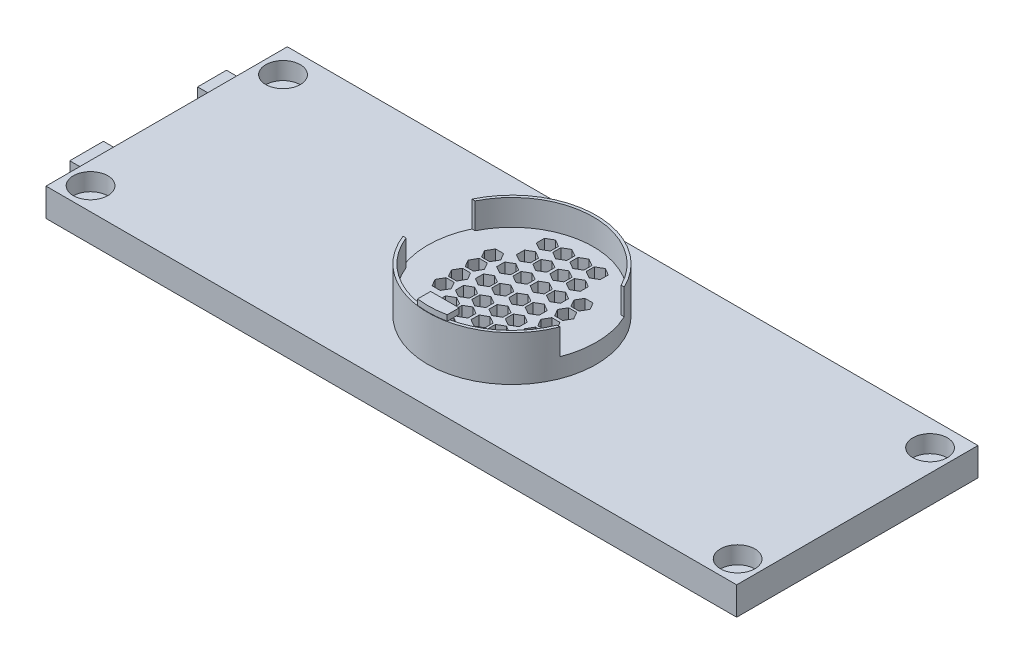
from build123d import *

# Parameters (mm, degrees)
SKETCH1_W           = 122.98346252
SKETCH1_H           = 42.97487903
BOSS_EXTRUDE1_DEPTH = 5
SKETCH3_R           = 3.075
CUT_EXTRUDE1_DEPTH  = 3.1
SKETCH5_W           = 5.142433448
SKETCH5_H           = 2
SKETCH5_W_2         = 6
SKETCH5_H_2         = 2.003550683
BOSS_EXTRUDE2_DEPTH = 3.1
SKETCH6_R           = 15
BOSS_EXTRUDE3_DEPTH = 8
SKETCH8_R           = 14.5
CUT_EXTRUDE2_DEPTH  = 4.6
SKETCH9_W           = 39.287811744
SKETCH9_H           = 11.865369085
CUT_EXTRUDE5_DEPTH  = 9.6
BOSS_EXTRUDE5_DEPTH = 1
CUT_EXTRUDE6_DEPTH  = 10


with BuildPart() as part:
    # Sketch1 → Boss-Extrude1 (new body)
    with BuildSketch(Plane(origin=(0, 0, 0), x_dir=(1, 0, 0), z_dir=(0, 1, 0))):
        Rectangle(SKETCH1_W, SKETCH1_H)
    extrude(amount=BOSS_EXTRUDE1_DEPTH)

    # Sketch3 → Cut-Extrude1 (cut)
    with BuildSketch(Plane(origin=(0, 5, 0), x_dir=(1, 0, 0), z_dir=(0, 1, 0))):
        with Locations(Location((-57.580191112, 16.807489546, 0), (0, 0, 270))):
            Circle(SKETCH3_R)
        with Locations(Location((-57.580191112, -17.461046338, 0), (0, 0, 270))):
            Circle(SKETCH3_R)
        with Locations(Location((57.567673953, 16.878323528, 0), (0, 0, 270))):
            Circle(SKETCH3_R)
        with Locations(Location((57.567673953, -17.390212356, 0), (0, 0, 270))):
            Circle(SKETCH3_R)
    extrude(amount=-CUT_EXTRUDE1_DEPTH, mode=Mode.SUBTRACT)

    # Sketch5 → Boss-Extrude2 (add)
    with BuildSketch(Plane.ZY.offset(61.49173126)):
        with Locations((-11.176561417, 2.70029737)):
            Rectangle(SKETCH5_W, SKETCH5_H)
        with Locations((11.157157367, 2.691921307)):
            Rectangle(SKETCH5_W_2, SKETCH5_H_2)
    extrude(amount=BOSS_EXTRUDE2_DEPTH)

    # Sketch6 → Boss-Extrude3 (add)
    with BuildSketch(Plane(origin=(0, 5, 0), x_dir=(1, 0, 0), z_dir=(0, 1, 0))):
        with Locations(Location((0, 0, 0), (0, 0, 270))):
            Circle(SKETCH6_R)
    extrude(amount=BOSS_EXTRUDE3_DEPTH)

    # Sketch8 → Cut-Extrude2 (cut)
    with BuildSketch(Plane(origin=(0, 13, 0), x_dir=(1, 0, 0), z_dir=(0, 1, 0))):
        with Locations(Location((0, 0, 0), (0, 0, 270))):
            Circle(SKETCH8_R)
    extrude(amount=-CUT_EXTRUDE2_DEPTH, mode=Mode.SUBTRACT)

    # Sketch9 → Cut-Extrude5 (cut)
    with BuildSketch(Plane(origin=(0, 8.4, 0), x_dir=(1, 0, 0), z_dir=(0, 1, 0))):
        with Locations((1.303444601, 0.497081388)):
            Rectangle(SKETCH9_W, SKETCH9_H)
    extrude(amount=CUT_EXTRUDE5_DEPTH, mode=Mode.SUBTRACT)

    # Sketch11 → Boss-Extrude5 (add)
    with BuildSketch(Plane(origin=(0, 13, 0), x_dir=(1, 0, 0), z_dir=(0, 1, 0))):
        with BuildLine():
            Line((-2.008566412, -12.483358221), (-2.008566412, -14.813807369))
            ThreePointArc((-2.008566412, -14.813807369), (0.540430025, -14.915750705), (3.072767456, -14.607461209))
            Line((3.072767456, -14.607461209), (3.072767456, -12.483358221))
            Line((3.072767456, -12.483358221), (-2.008566412, -12.483358221))
        make_face()
    extrude(amount=BOSS_EXTRUDE5_DEPTH)

    # Sketch12 → Cut-Extrude6 (cut)
    with BuildSketch(Plane.XZ):
        Polygon((-1.381374518, -4.971139616), (-0.132784083, -4.250265592), (-0.132784083, -2.808517545), (-1.381374518, -2.087643522), (-2.629964952, -2.808517545), (-2.629964952, -4.250265592), align=None)
        Polygon((-4.289587549, -4.971139616), (-3.040997114, -4.250265592), (-3.040997114, -2.808517545), (-4.289587549, -2.087643522), (-5.538177984, -2.808517545), (-5.538177984, -4.250265592), align=None)
        Polygon((4.546381521, -5.001007602), (5.794971955, -4.280133578), (5.794971955, -2.838385531), (4.546381521, -2.117511507), (3.297791086, -2.838385531), (3.297791086, -4.280133578), align=None)
        Polygon((1.638168489, -5.001007602), (2.886758924, -4.280133578), (2.886758924, -2.838385531), (1.638168489, -2.117511507), (0.389578055, -2.838385531), (0.389578055, -4.280133578), align=None)
        Polygon((-1.44283189, -1.23420754), (-0.194241456, -0.513333516), (-0.194241456, 0.928414531), (-1.44283189, 1.649288554), (-2.691422325, 0.928414531), (-2.691422325, -0.513333516), align=None)
        Polygon((-4.351044922, -1.23420754), (-3.102454487, -0.513333516), (-3.102454487, 0.928414531), (-4.351044922, 1.649288554), (-5.599635356, 0.928414531), (-5.599635356, -0.513333516), align=None)
        Polygon((4.484924148, -1.264075525), (5.733514583, -0.543201502), (5.733514583, 0.898546545), (4.484924148, 1.619420569), (3.236333713, 0.898546545), (3.236333713, -0.543201502), align=None)
        Polygon((1.576711117, -1.264075525), (2.825301551, -0.543201502), (2.825301551, 0.898546545), (1.576711117, 1.619420569), (0.328120682, 0.898546545), (0.328120682, -0.543201502), align=None)
        Polygon((-1.44283189, 2.30846757), (-0.194241456, 3.029341594), (-0.194241456, 4.471089641), (-1.44283189, 5.191963664), (-2.691422325, 4.471089641), (-2.691422325, 3.029341594), align=None)
        Polygon((-4.351044922, 2.30846757), (-3.102454487, 3.029341594), (-3.102454487, 4.471089641), (-4.351044922, 5.191963664), (-5.599635356, 4.471089641), (-5.599635356, 3.029341594), align=None)
        Polygon((4.484924148, 2.278599584), (5.733514583, 2.999473608), (5.733514583, 4.441221655), (4.484924148, 5.162095679), (3.236333713, 4.441221655), (3.236333713, 2.999473608), align=None)
        Polygon((1.576711117, 2.278599584), (2.825301551, 2.999473608), (2.825301551, 4.441221655), (1.576711117, 5.162095679), (0.328120682, 4.441221655), (0.328120682, 2.999473608), align=None)
        Polygon((-1.424844788, 5.51653605), (-0.176254353, 6.237410074), (-0.176254353, 7.679158121), (-1.424844788, 8.400032145), (-2.673435223, 7.679158121), (-2.673435223, 6.237410074), align=None)
        Polygon((-4.333057819, 5.51653605), (-3.084467385, 6.237410074), (-3.084467385, 7.679158121), (-4.333057819, 8.400032145), (-5.581648254, 7.679158121), (-5.581648254, 6.237410074), align=None)
        Polygon((4.50291125, 5.486668065), (5.751501685, 6.207542088), (5.751501685, 7.649290135), (4.50291125, 8.370164159), (3.254320816, 7.649290135), (3.254320816, 6.207542088), align=None)
        Polygon((1.594698219, 5.486668065), (2.843288654, 6.207542088), (2.843288654, 7.649290135), (1.594698219, 8.370164159), (0.346107784, 7.649290135), (0.346107784, 6.207542088), align=None)
        Polygon((-1.406449515, 8.922934367), (-0.157859081, 9.643808391), (-0.157859081, 11.085556438), (-1.406449515, 11.806430461), (-2.65503995, 11.085556438), (-2.65503995, 9.643808391), align=None)
        Polygon((-4.314662547, 8.922934367), (-3.066072112, 9.643808391), (-3.066072112, 11.085556438), (-4.314662547, 11.806430461), (-5.563252981, 11.085556438), (-5.563252981, 9.643808391), align=None)
        Polygon((4.521306523, 8.893066382), (5.769896958, 9.613940405), (5.769896958, 11.055688452), (4.521306523, 11.776562476), (3.272716088, 11.055688452), (3.272716088, 9.613940405), align=None)
        Polygon((1.613093492, 8.893066382), (2.861683926, 9.613940405), (2.861683926, 11.055688452), (1.613093492, 11.776562476), (0.364503057, 11.055688452), (0.364503057, 9.613940405), align=None)
        Polygon((-1.466720513, -8.578903548), (-0.218130079, -7.858029525), (-0.218130079, -6.416281478), (-1.466720513, -5.695407454), (-2.715310948, -6.416281478), (-2.715310948, -7.858029525), align=None)
        Polygon((-4.374933545, -8.578903548), (-3.12634311, -7.858029525), (-3.12634311, -6.416281478), (-4.374933545, -5.695407454), (-5.623523979, -6.416281478), (-5.623523979, -7.858029525), align=None)
        Polygon((4.461035525, -8.608771534), (5.70962596, -7.88789751), (5.70962596, -6.446149463), (4.461035525, -5.72527544), (3.212445091, -6.446149463), (3.212445091, -7.88789751), align=None)
        Polygon((1.552822494, -8.608771534), (2.801412928, -7.88789751), (2.801412928, -6.446149463), (1.552822494, -5.72527544), (0.304232059, -6.446149463), (0.304232059, -7.88789751), align=None)
        Polygon((-1.502478081, -12.162894804), (-0.253887646, -11.44202078), (-0.253887646, -10.000272733), (-1.502478081, -9.27939871), (-2.751068515, -10.000272733), (-2.751068515, -11.44202078), align=None)
        Polygon((-4.410691112, -12.162894804), (-3.162100678, -11.44202078), (-3.162100678, -10.000272733), (-4.410691112, -9.27939871), (-5.659281547, -10.000272733), (-5.659281547, -11.44202078), align=None)
        Polygon((4.425277958, -12.19276279), (5.673868392, -11.471888766), (5.673868392, -10.030140719), (4.425277958, -9.309266696), (3.176687523, -10.030140719), (3.176687523, -11.471888766), align=None)
        Polygon((1.517064926, -12.19276279), (2.765655361, -11.471888766), (2.765655361, -10.030140719), (1.517064926, -9.309266696), (0.268474492, -10.030140719), (0.268474492, -11.471888766), align=None)
        Polygon((-6.210185925, -1.290453118), (-6.931059949, -0.041862683), (-8.372807996, -0.041862683), (-9.09368202, -1.290453118), (-8.372807996, -2.539043553), (-6.931059949, -2.539043553), align=None)
        Polygon((-6.210185925, -4.198666149), (-6.931059949, -2.950075715), (-8.372807996, -2.950075715), (-9.09368202, -4.198666149), (-8.372807996, -5.447256584), (-6.931059949, -5.447256584), align=None)
        Polygon((-6.18031794, 4.63730292), (-6.901191963, 5.885893355), (-8.34294001, 5.885893355), (-9.063814034, 4.63730292), (-8.34294001, 3.388712486), (-6.901191963, 3.388712486), align=None)
        Polygon((-6.18031794, 1.729089889), (-6.901191963, 2.977680324), (-8.34294001, 2.977680324), (-9.063814034, 1.729089889), (-8.34294001, 0.480499454), (-6.901191963, 0.480499454), align=None)
        Polygon((9.364060005, -1.631856694), (8.643185981, -0.383266259), (7.201437934, -0.383266259), (6.480563911, -1.631856694), (7.201437934, -2.880447128), (8.643185981, -2.880447128), align=None)
        Polygon((9.364060005, -4.540069725), (8.643185981, -3.29147929), (7.201437934, -3.29147929), (6.480563911, -4.540069725), (7.201437934, -5.78866016), (8.643185981, -5.78866016), align=None)
        Polygon((9.393927991, 4.295899345), (8.673053967, 5.544489779), (7.23130592, 5.544489779), (6.510431896, 4.295899345), (7.23130592, 3.04730891), (8.673053967, 3.04730891), align=None)
        Polygon((9.393927991, 1.387686313), (8.673053967, 2.636276748), (7.23130592, 2.636276748), (6.510431896, 1.387686313), (7.23130592, 0.139095879), (8.673053967, 0.139095879), align=None)
    extrude(amount=-CUT_EXTRUDE6_DEPTH, mode=Mode.SUBTRACT)


solid = part.part
